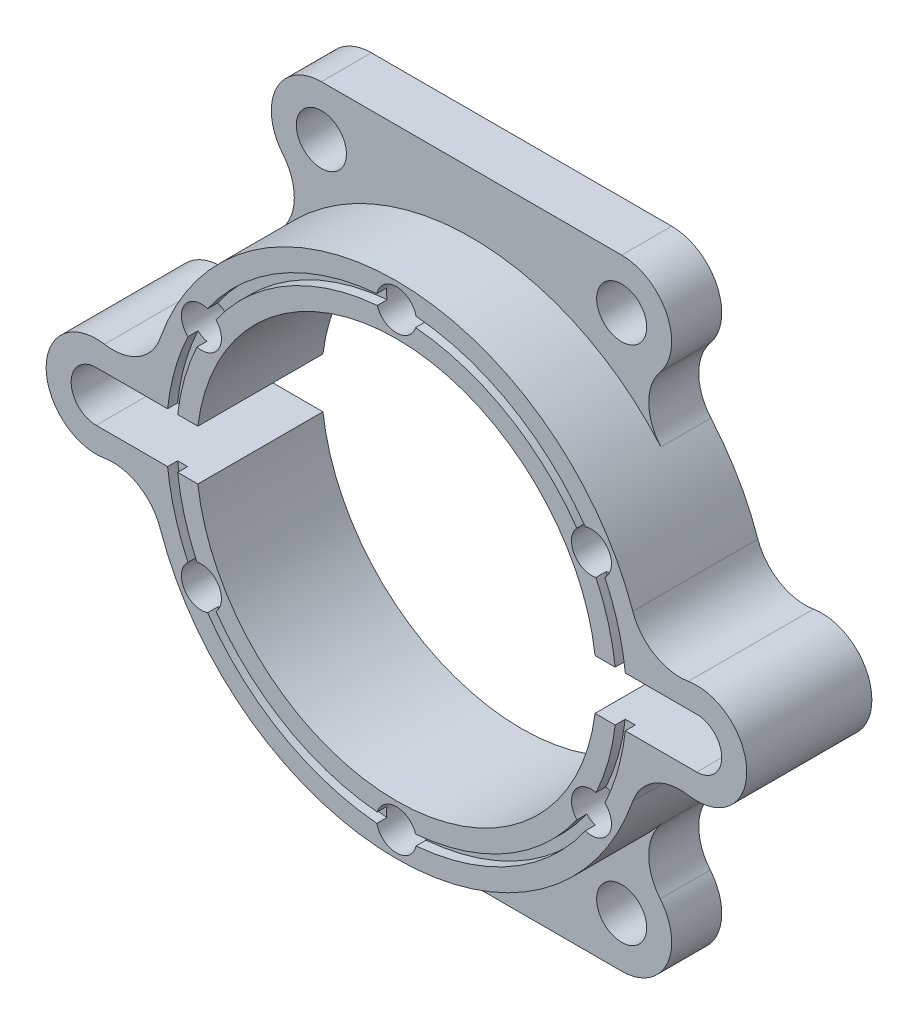
from build123d import *

# Parameters (mm, degrees)
SKETCH2_R             = 5
BOSS_EXTRUDE1_DEPTH   = 10
BOSS_EXTRUDE1_2_DEPTH = 10
BOSS_EXTRUDE2_DEPTH   = 25
BOSS_EXTRUDE3_DEPTH   = 23


with BuildPart() as part:
    # Sketch2 → Boss-Extrude1 (new body)
    with BuildSketch(Plane.XY):
        with BuildLine():
            Line((30, 61.961524227), (-30, 61.961524227))
            ThreePointArc((-30, 61.961524227), (-39.04805011, 56.219785516), (-37.705792305, 45.588082068))
            ThreePointArc((-37.705792305, 45.588082068), (-35.412149299, 39.10836922), (-37.842987175, 32.678866591))
            ThreePointArc((-37.842987175, 32.678866591), (0, 50), (37.842987175, 32.678866591))
            ThreePointArc((37.842987175, 32.678866591), (35.412149299, 39.10836922), (37.705792305, 45.588082068))
            ThreePointArc((37.705792305, 45.588082068), (39.04805011, 56.219785516), (30, 61.961524227))
        make_face()
        with Locations((-30, 51.961524227)):
            Circle(SKETCH2_R, mode=Mode.SUBTRACT)
        with Locations((30, 51.961524227)):
            Circle(SKETCH2_R, mode=Mode.SUBTRACT)
    extrude(amount=BOSS_EXTRUDE1_DEPTH)



with BuildPart() as body_2:
    # Sketch2 → Boss-Extrude1 2 (new body)
    with BuildSketch(Plane.XY):
        with BuildLine():
            ThreePointArc((37.842987175, -32.678866591), (0, -50), (-37.842987175, -32.678866591))
            ThreePointArc((-37.842987175, -32.678866591), (-35.412149299, -39.10836922), (-37.705792305, -45.588082068))
            ThreePointArc((-37.705792305, -45.588082068), (-39.04805011, -56.219785516), (-30, -61.961524227))
            Line((-30, -61.961524227), (30, -61.961524227))
            ThreePointArc((30, -61.961524227), (39.04805011, -56.219785516), (37.705792305, -45.588082068))
            ThreePointArc((37.705792305, -45.588082068), (35.412149299, -39.10836922), (37.842987175, -32.678866591))
        make_face()
        with Locations((-30, -51.961524227)):
            Circle(SKETCH2_R, mode=Mode.SUBTRACT)
        with Locations((30, -51.961524227)):
            Circle(SKETCH2_R, mode=Mode.SUBTRACT)
    extrude(amount=BOSS_EXTRUDE1_2_DEPTH)


with BuildPart() as part_1:
    add(part.part)

    add(body_2.part)  # Boss-Extrude2 merges body 2
    # Sketch2<3> → Boss-Extrude2 (add)
    # profile 1 of 3: a face of its own
    with BuildSketch(Plane.XY):
        with BuildLine():
            ThreePointArc((47.222222222, 16.433554953), (0, 50), (-47.222222222, 16.433554953))
            ThreePointArc((-47.222222222, 16.433554953), (-51.574915894, 11.113636285), (-58.333333333, 9.860132972))
            ThreePointArc((-58.333333333, 9.860132972), (-70, 0), (-58.333333333, -9.860132972))
            ThreePointArc((-58.333333333, -9.860132972), (-51.574915894, -11.113636285), (-47.222222222, -16.433554953))
            ThreePointArc((-47.222222222, -16.433554953), (0, -50), (47.222222222, -16.433554953))
            ThreePointArc((47.222222222, -16.433554953), (51.574915894, -11.113636285), (58.333333333, -9.860132972))
            ThreePointArc((58.333333333, -9.860132972), (70, 0), (58.333333333, 9.860132972))
            ThreePointArc((58.333333333, 9.860132972), (51.574915894, 11.113636285), (47.222222222, 16.433554953))
        make_face()
        with BuildLine():
            Line((-60, 5), (-45.727453461, 5))
            ThreePointArc((-45.727453461, 5), (-44.288019832, 12.432670643), (-41.648946773, 19.528574775))
            ThreePointArc((-41.648946773, 19.528574775), (-42.435244785, 24.5), (-37.736715241, 26.304758558))
            ThreePointArc((-37.736715241, 26.304758558), (-23, 39.837168574), (-3.912231531, 45.833333333))
            ThreePointArc((-3.912231531, 45.833333333), (0, 49), (3.912231531, 45.833333333))
            ThreePointArc((3.912231531, 45.833333333), (23, 39.837168574), (37.736715241, 26.304758558))
            ThreePointArc((37.736715241, 26.304758558), (42.435244785, 24.5), (41.648946773, 19.528574775))
            ThreePointArc((41.648946773, 19.528574775), (44.288019832, 12.432670643), (45.727453461, 5))
            Line((45.727453461, 5), (60, 5))
            ThreePointArc((60, 5), (65, 0), (60, -5))
            Line((60, -5), (45.727453461, -5))
            ThreePointArc((45.727453461, -5), (44.288019832, -12.432670643), (41.648946773, -19.528574775))
            ThreePointArc((41.648946773, -19.528574775), (42.435244785, -24.5), (37.736715241, -26.304758558))
            ThreePointArc((37.736715241, -26.304758558), (23, -39.837168574), (3.912231531, -45.833333333))
            ThreePointArc((3.912231531, -45.833333333), (0, -49), (-3.912231531, -45.833333333))
            ThreePointArc((-3.912231531, -45.833333333), (-23, -39.837168574), (-37.736715241, -26.304758558))
            ThreePointArc((-37.736715241, -26.304758558), (-42.435244785, -24.5), (-41.648946773, -19.528574775))
            ThreePointArc((-41.648946773, -19.528574775), (-44.288019832, -12.432670643), (-45.727453461, -5))
            Line((-45.727453461, -5), (-60, -5))
            ThreePointArc((-60, -5), (-65, 0), (-60, 5))
        make_face(mode=Mode.SUBTRACT)
    # profile 2 of 3: a face of its own
    with BuildSketch(Plane.XY):
        with BuildLine():
            Line((-39.686269666, -5), (-43.714985989, -5))
            ThreePointArc((-43.714985989, -5), (-42.344229671, -11.956847978), (-39.873820246, -18.603184108))
            ThreePointArc((-39.873820246, -18.603184108), (-35.507041555, -20.5), (-36.047740152, -25.230149225))
            ThreePointArc((-36.047740152, -25.230149225), (-22, -38.105117767), (-3.826080094, -43.833333333))
            ThreePointArc((-3.826080094, -43.833333333), (0, -41), (3.826080094, -43.833333333))
            ThreePointArc((3.826080094, -43.833333333), (22, -38.105117767), (36.047740152, -25.230149225))
            ThreePointArc((36.047740152, -25.230149225), (35.507041555, -20.5), (39.873820246, -18.603184108))
            ThreePointArc((39.873820246, -18.603184108), (42.344229671, -11.956847978), (43.714985989, -5))
            Line((43.714985989, -5), (39.686269666, -5))
            ThreePointArc((39.686269666, -5), (0, -40), (-39.686269666, -5))
        make_face()
    # profile 3 of 3: a face of its own
    with BuildSketch(Plane.XY):
        with BuildLine():
            Line((-43.714985989, 5), (-39.686269666, 5))
            ThreePointArc((-39.686269666, 5), (0, 40), (39.686269666, 5))
            Line((39.686269666, 5), (43.714985989, 5))
            ThreePointArc((43.714985989, 5), (42.344229671, 11.956847978), (39.873820246, 18.603184108))
            ThreePointArc((39.873820246, 18.603184108), (35.507041555, 20.5), (36.047740152, 25.230149225))
            ThreePointArc((36.047740152, 25.230149225), (22, 38.105117767), (3.826080094, 43.833333333))
            ThreePointArc((3.826080094, 43.833333333), (0, 41), (-3.826080094, 43.833333333))
            ThreePointArc((-3.826080094, 43.833333333), (-22, 38.105117767), (-36.047740152, 25.230149225))
            ThreePointArc((-36.047740152, 25.230149225), (-35.507041555, 20.5), (-39.873820246, 18.603184108))
            ThreePointArc((-39.873820246, 18.603184108), (-42.344229671, 11.956847978), (-43.714985989, 5))
        make_face()
    extrude(amount=BOSS_EXTRUDE2_DEPTH)

    # Sketch2<4> → Boss-Extrude3 (add)
    with BuildSketch(Plane.XY):
        with BuildLine():
            Line((-45.727453461, 5), (-43.714985989, 5))
            ThreePointArc((-43.714985989, 5), (-42.344229671, 11.956847978), (-39.873820246, 18.603184108))
            ThreePointArc((-39.873820246, 18.603184108), (-40.820209812, 18.95303615), (-41.648946773, 19.528574775))
            ThreePointArc((-41.648946773, 19.528574775), (-44.288019832, 12.432670643), (-45.727453461, 5))
        make_face()
        with BuildLine():
            ThreePointArc((39.873820246, 18.603184108), (42.344229671, 11.956847978), (43.714985989, 5))
            Line((43.714985989, 5), (45.727453461, 5))
            ThreePointArc((45.727453461, 5), (44.288019832, 12.432670643), (41.648946773, 19.528574775))
            ThreePointArc((41.648946773, 19.528574775), (40.820209812, 18.95303615), (39.873820246, 18.603184108))
        make_face()
        with BuildLine():
            ThreePointArc((-3.912231531, 45.833333333), (-23, 39.837168574), (-37.736715241, 26.304758558))
            ThreePointArc((-37.736715241, 26.304758558), (-36.82391569, 25.87482061), (-36.047740152, 25.230149225))
            ThreePointArc((-36.047740152, 25.230149225), (-22, 38.105117767), (-3.826080094, 43.833333333))
            ThreePointArc((-3.826080094, 43.833333333), (-3.996294121, 44.827856759), (-3.912231531, 45.833333333))
        make_face()
        with BuildLine():
            ThreePointArc((3.826080094, 43.833333333), (22, 38.105117767), (36.047740152, 25.230149225))
            ThreePointArc((36.047740152, 25.230149225), (36.82391569, 25.87482061), (37.736715241, 26.304758558))
            ThreePointArc((37.736715241, 26.304758558), (23, 39.837168574), (3.912231531, 45.833333333))
            ThreePointArc((3.912231531, 45.833333333), (3.996294121, 44.827856759), (3.826080094, 43.833333333))
        make_face()
        with BuildLine():
            Line((-43.714985989, -5), (-45.727453461, -5))
            ThreePointArc((-45.727453461, -5), (-44.288019832, -12.432670643), (-41.648946773, -19.528574775))
            ThreePointArc((-41.648946773, -19.528574775), (-40.820209812, -18.95303615), (-39.873820246, -18.603184108))
            ThreePointArc((-39.873820246, -18.603184108), (-42.344229671, -11.956847978), (-43.714985989, -5))
        make_face()
        with BuildLine():
            ThreePointArc((41.648946773, -19.528574775), (44.288019832, -12.432670643), (45.727453461, -5))
            Line((45.727453461, -5), (43.714985989, -5))
            ThreePointArc((43.714985989, -5), (42.344229671, -11.956847978), (39.873820246, -18.603184108))
            ThreePointArc((39.873820246, -18.603184108), (40.820209812, -18.95303615), (41.648946773, -19.528574775))
        make_face()
        with BuildLine():
            ThreePointArc((-36.047740152, -25.230149225), (-36.82391569, -25.87482061), (-37.736715241, -26.304758558))
            ThreePointArc((-37.736715241, -26.304758558), (-23, -39.837168574), (-3.912231531, -45.833333333))
            ThreePointArc((-3.912231531, -45.833333333), (-3.996294121, -44.827856759), (-3.826080094, -43.833333333))
            ThreePointArc((-3.826080094, -43.833333333), (-22, -38.105117767), (-36.047740152, -25.230149225))
        make_face()
        with BuildLine():
            ThreePointArc((3.826080094, -43.833333333), (3.996294121, -44.827856759), (3.912231531, -45.833333333))
            ThreePointArc((3.912231531, -45.833333333), (23, -39.837168574), (37.736715241, -26.304758558))
            ThreePointArc((37.736715241, -26.304758558), (36.82391569, -25.87482061), (36.047740152, -25.230149225))
            ThreePointArc((36.047740152, -25.230149225), (22, -38.105117767), (3.826080094, -43.833333333))
        make_face()
    extrude(amount=BOSS_EXTRUDE3_DEPTH)


solid = part_1.part
